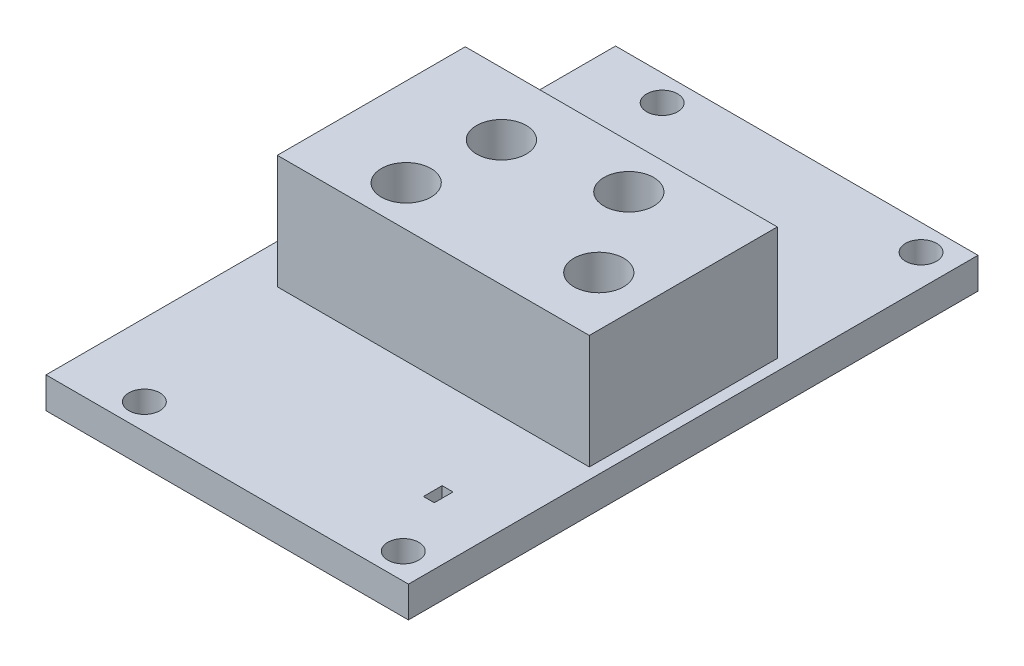
from build123d import *

# Parameters (mm, degrees)
SKETCH1_W               = 35
SKETCH1_H               = 55
SKETCH1_R               = 1.5
SKETCH1_W_2             = 1.053264105
SKETCH1_H_2             = 1.810086697
BOSS_EXTRUDE1_DEPTH     = 3
SKETCH2_W               = 30.130506089
SKETCH2_H               = 18.151203477
BOSS_EXTRUDE2_DEPTH     = 11
SKETCH4_W               = 25.972666726
SKETCH4_H               = 17.735623468
CUT_EXTRUDE2_DEPTH      = 4
CUT_EXTRUDE3_DEPTH      = 36.47534355
CUT_EXTRUDE3_DEPTH_BACK = 36.47534355
SKETCH6_R               = 2.4
CUT_EXTRUDE4_DEPTH      = 35.095454242
CUT_EXTRUDE4_DEPTH_BACK = 2.5
SKETCH7_R               = 3.75


with BuildPart() as part:
    # Sketch1 → Boss-Extrude1 (new body)
    with BuildSketch(Plane(origin=(0, 0, 0), x_dir=(1, 0, 0), z_dir=(0, 1, 0))):
        Rectangle(SKETCH1_W, SKETCH1_H)
        with Locations(Location((14.5, 25, 0), (0, 0, 270))):
            Circle(SKETCH1_R, mode=Mode.SUBTRACT)
        with Locations(Location((-10.5, 25, 0), (0, 0, 270))):
            Circle(SKETCH1_R, mode=Mode.SUBTRACT)
        with Locations(Location((14.5, -25, 0), (0, 0, 270))):
            Circle(SKETCH1_R, mode=Mode.SUBTRACT)
        with Locations(Location((-10.5, -25, 0), (0, 0, 270))):
            Circle(SKETCH1_R, mode=Mode.SUBTRACT)
        with Locations((11.420031076, -18.543755043)):
            Rectangle(SKETCH1_W_2, SKETCH1_H_2, mode=Mode.SUBTRACT)
    extrude(amount=BOSS_EXTRUDE1_DEPTH)

    # Sketch2 → Boss-Extrude2 (add)
    with BuildSketch(Plane(origin=(0, 3, 0), x_dir=(1, 0, 0), z_dir=(0, 1, 0))):
        with Locations((1.371677436, 0.106547158)):
            Rectangle(SKETCH2_W, SKETCH2_H)
    extrude(amount=BOSS_EXTRUDE2_DEPTH)

    # Sketch4 → Cut-Extrude2 (cut)
    with BuildSketch(Plane.XZ):
        with Locations((1.214862274, -0.038232514)):
            Rectangle(SKETCH4_W, SKETCH4_H)
    extrude(amount=-CUT_EXTRUDE2_DEPTH, mode=Mode.SUBTRACT)

    # Sketch6 → Cut-Extrude3 (cut, two sides: drawn at the far end of the back side and taken through both)
    with BuildSketch(Plane.XZ.offset(-CUT_EXTRUDE3_DEPTH_BACK)):
        with Locations(Location((11.63, 3.25, 0), (0, 0, 270))):
            Circle(SKETCH6_R)
        with Locations(Location((-5.17, 5.05, 0), (0, 0, 270))):
            Circle(SKETCH6_R)
        with Locations(Location((-4.17, -3.15, 0), (0, 0, 270))):
            Circle(SKETCH6_R)
        with Locations(Location((6.33, -4.95, 0), (0, 0, 270))):
            Circle(SKETCH6_R)
    extrude(amount=CUT_EXTRUDE3_DEPTH + CUT_EXTRUDE3_DEPTH_BACK, mode=Mode.SUBTRACT)

    # Sketch7 → Cut-Extrude4 (cut, two sides: drawn at the far end of the back side and taken through both)
    with BuildSketch(Plane.XZ.offset(-4).offset(-CUT_EXTRUDE4_DEPTH_BACK)):
        with Locations(Location((-5.17, 5.05, 0), (0, 0, 90))):
            Circle(SKETCH7_R)
        with Locations(Location((-4.17, -3.15, 0), (0, 0, 90))):
            Circle(SKETCH7_R)
        with Locations(Location((6.33, -4.95, 0), (0, 0, 90))):
            Circle(SKETCH7_R)
        with Locations(Location((11.63, 3.25, 0), (0, 0, 46.713081775))):
            Circle(SKETCH7_R)
    extrude(amount=CUT_EXTRUDE4_DEPTH + CUT_EXTRUDE4_DEPTH_BACK, mode=Mode.SUBTRACT)


solid = part.part
